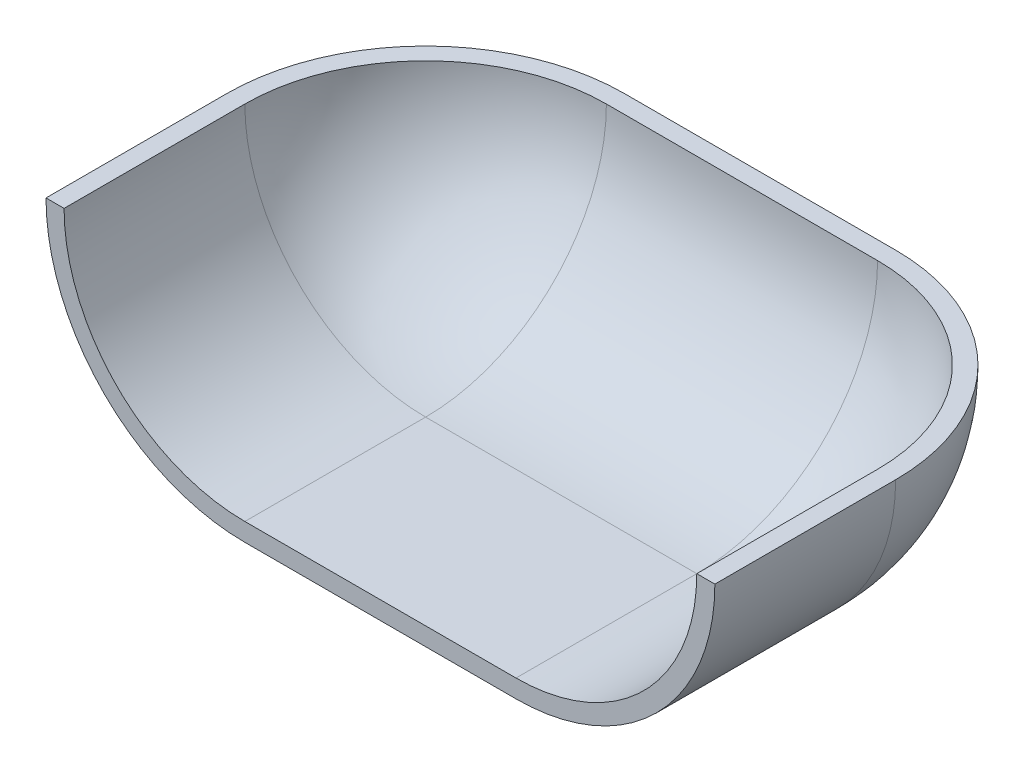
from build123d import *

# Parameters (mm, degrees)
REVOLVE_THIN1_ANGLE = 90
EXTRUDE_THIN1_DEPTH = 12.7


with BuildPart() as part:
    # Sketch1 → Revolve-Thin1 (revolve)
    with BuildSketch(Plane.XY):
        with BuildLine():
            ThreePointArc((-12.7, 12.7), (-8.980256121, 3.719743879), (0, 0))
            Line((0, 0), (19.05, 0))
            ThreePointArc((19.05, 0), (28.030256121, 3.719743879), (31.75, 12.7))
            Line((31.75, 12.7), (33.02, 12.7))
            ThreePointArc((33.02, 12.7), (28.928281733, 2.821718267), (19.05, -1.27))
            Line((19.05, -1.27), (0, -1.27))
            ThreePointArc((0, -1.27), (-9.878281733, 2.821718267), (-13.97, 12.7))
            Line((-13.97, 12.7), (-12.7, 12.7))
        make_face()
    revolve(axis=Axis((-12.7, 12.7, 0), (1, 0, 0)), revolution_arc=REVOLVE_THIN1_ANGLE)

    # Sketch1<2> → Extrude-Thin1 (add)
    with BuildSketch(Plane.XY):
        with BuildLine():
            ThreePointArc((-12.7, 12.7), (-8.980256121, 3.719743879), (0, 0))
            Line((0, 0), (19.05, 0))
            ThreePointArc((19.05, 0), (28.030256121, 3.719743879), (31.75, 12.7))
            Line((31.75, 12.7), (33.02, 12.7))
            ThreePointArc((33.02, 12.7), (28.928281733, 2.821718267), (19.05, -1.27))
            Line((19.05, -1.27), (0, -1.27))
            ThreePointArc((0, -1.27), (-9.878281733, 2.821718267), (-13.97, 12.7))
            Line((-13.97, 12.7), (-12.7, 12.7))
        make_face()
    extrude(amount=EXTRUDE_THIN1_DEPTH)


solid = part.part
